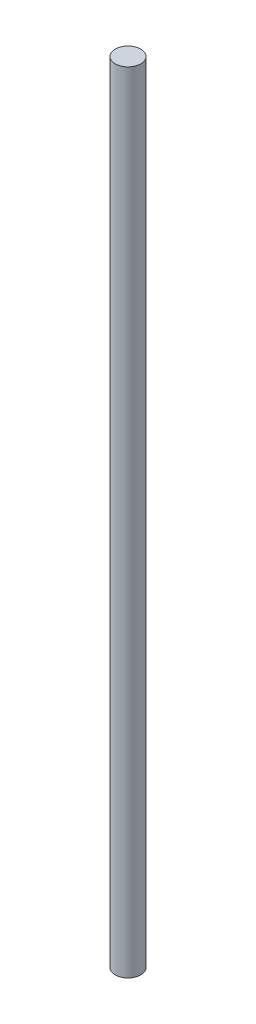
from build123d import *

# Parameters (mm, degrees)
SKETCH1_R           = 4.953
BOSS_EXTRUDE1_DEPTH = 305.562


with BuildPart() as part:
    # Sketch1 → Boss-Extrude1 (new body)
    with BuildSketch(Plane(origin=(0, 0, 0), x_dir=(1, 0, 0), z_dir=(0, 1, 0))):
        with Locations(Location((0, 0, 0), (0, 0, 270))):
            Circle(SKETCH1_R)
    extrude(amount=BOSS_EXTRUDE1_DEPTH)


solid = part.part
